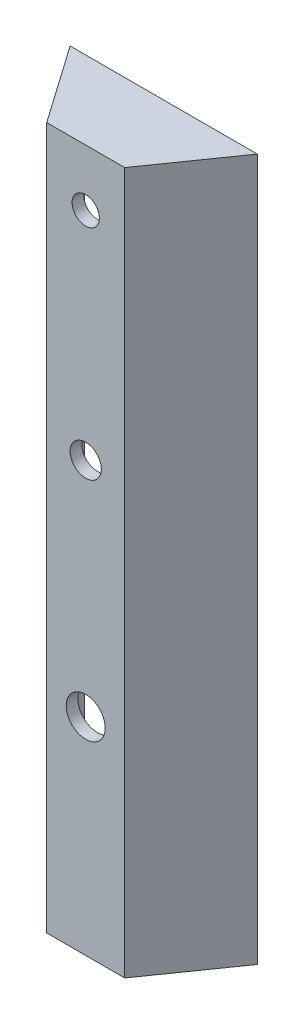
from build123d import *

# Parameters (mm, degrees)
BOSS_EXTRUDE1_DEPTH     = 2286
SHELL3_T                = -38.1
CUT_EXTRUDE1_DEPTH      = 2321.175648523
CUT_EXTRUDE1_DEPTH_BACK = 2321.175648523
SKETCH2_R               = 44.45
SKETCH2_R_2             = 50.8
SKETCH2_R_3             = 63.5


with BuildPart() as part:
    # Sketch1 → Boss-Extrude1 (new body)
    with BuildSketch(Plane(origin=(0, 0, 0), x_dir=(1, 0, 0), z_dir=(0, 1, 0))):
        Polygon((-304.8, 0), (304.8, 0), (127, -254), (-127, -254), align=None)
    extrude(amount=BOSS_EXTRUDE1_DEPTH)

    # Shell3
    shell3_openings = [part.faces().sort_by_distance(p)[0] for p in [
        (0, 1143, 0),
    ]]
    offset(amount=SHELL3_T, openings=shell3_openings, kind=Kind.INTERSECTION)

    # Sketch2 → Cut-Extrude1 (cut, two sides: drawn at the far end of the back side and taken through both)
    with BuildSketch(Plane.XY.offset(254).offset(-CUT_EXTRUDE1_DEPTH_BACK)):
        with Locations(Location((0, 2101.85, 0), (0, 0, 180))):
            Circle(SKETCH2_R)
        with Locations(Location((0, 1397, 0), (0, 0, 180))):
            Circle(SKETCH2_R_2)
        with Locations(Location((0, 673.1, 0), (0, 0, 180))):
            Circle(SKETCH2_R_3)
    extrude(amount=CUT_EXTRUDE1_DEPTH + CUT_EXTRUDE1_DEPTH_BACK, mode=Mode.SUBTRACT)


solid = part.part
